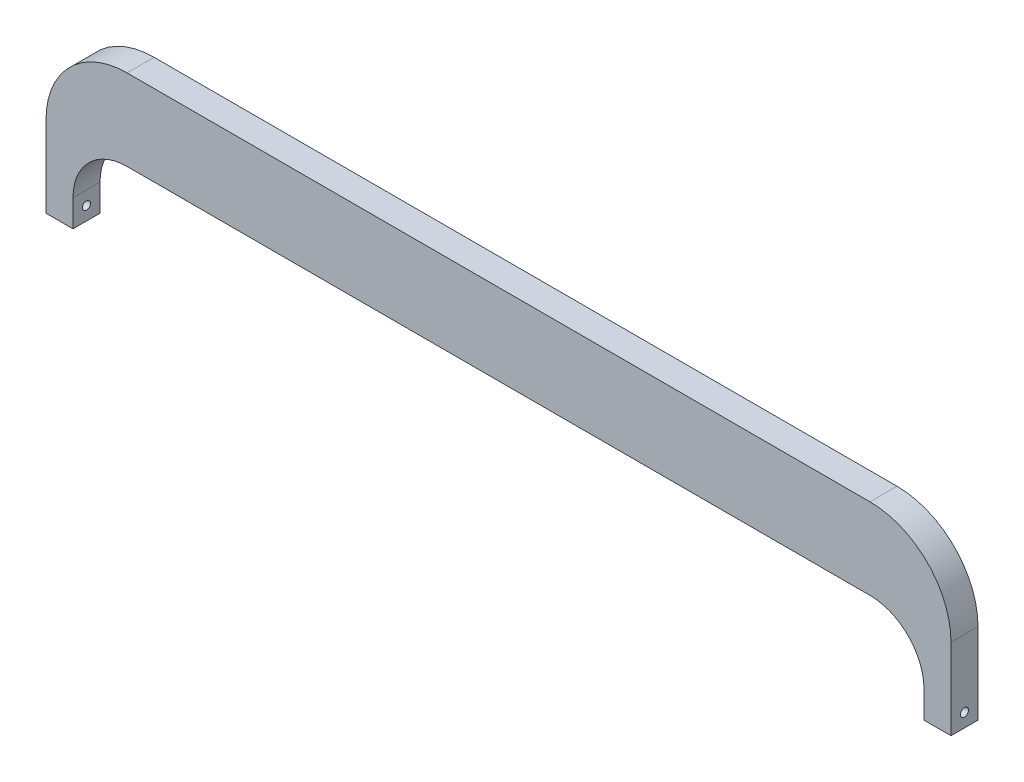
from build123d import *

# Parameters (mm, degrees)
BOSS_EXTRUDE8_DEPTH = 2
SKETCH4_R           = 0.3
CUT_EXTRUDE3_DEPTH  = 2
CUT_EXTRUDE4_START  = -2
SKETCH5_R           = 0.3
CUT_EXTRUDE4_DEPTH  = 2


with BuildPart() as part:
    # Sketch2 → Boss-Extrude8 (new body)
    with BuildSketch(Plane.XY):
        with BuildLine():
            Line((27.5, 0), (-27.5, 0))
            ThreePointArc((-27.5, 0), (-31.742640687, -1.757359313), (-33.5, -6))
            Line((-33.5, -6), (-33.5, -12))
            Line((-33.5, -12), (-31.5, -12))
            Line((-31.5, -12), (-31.5, -10))
            ThreePointArc((-31.5, -10), (-30.328427125, -7.171572875), (-27.5, -6))
            Line((-27.5, -6), (27.5, -6))
            ThreePointArc((27.5, -6), (30.328427125, -7.171572875), (31.5, -10))
            Line((31.5, -10), (31.5, -12))
            Line((31.5, -12), (33.5, -12))
            Line((33.5, -12), (33.5, -6))
            ThreePointArc((33.5, -6), (31.742640687, -1.757359313), (27.5, 0))
        make_face()
    extrude(amount=BOSS_EXTRUDE8_DEPTH)

    # Sketch4 → Cut-Extrude3 (cut)
    with BuildSketch(Plane(origin=(33.5, 0, 0), x_dir=(0, 0, -1), z_dir=(1, 0, 0))):
        with Locations((-1, -11)):
            Circle(SKETCH4_R)
    extrude(amount=-CUT_EXTRUDE3_DEPTH, mode=Mode.SUBTRACT)

    # Sketch5 → Cut-Extrude4 (cut)
    with BuildSketch(Plane.ZY.offset(33.5).offset(CUT_EXTRUDE4_START)):
        with Locations((1, -11)):
            Circle(SKETCH5_R)
    extrude(amount=CUT_EXTRUDE4_DEPTH, mode=Mode.SUBTRACT)


solid = part.part
